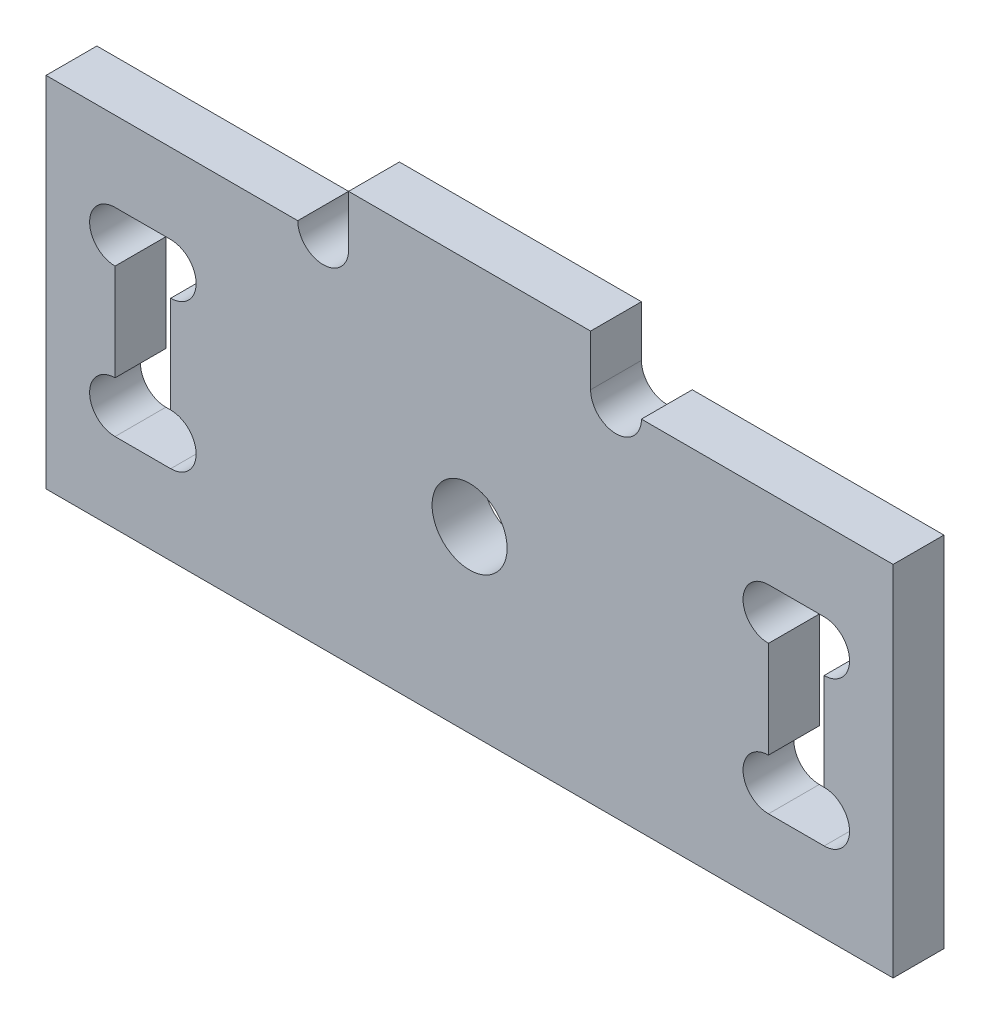
from build123d import *

# Parameters (mm, degrees)
SKETCH_1_R      = 1.55
EXTRUDE_1_DEPTH = 2.1


with BuildPart() as part:
    # 草图1 → 凸台-拉伸1 (new body)
    with BuildSketch(Plane.XY):
        with BuildLine():
            Line((-17.5, -7.4), (17.5, -7.4))
            Line((17.5, -7.4), (17.5, 7.4))
            Line((17.5, 7.4), (7.1, 7.4))
            ThreePointArc((7.1, 7.4), (6.05, 6.35), (5, 7.4))
            Line((5, 7.4), (5, 9.5))
            Line((5, 9.5), (-5, 9.5))
            Line((-5, 9.5), (-5, 7.4))
            ThreePointArc((-5, 7.4), (-6.05, 6.35), (-7.1, 7.4))
            Line((-7.1, 7.4), (-17.5, 7.4))
            Line((-17.5, 7.4), (-17.5, -7.4))
        make_face()
        with BuildLine():
            Line((-12.35, -4.1), (-14.65, -4.1))
            ThreePointArc((-14.65, -4.1), (-15.7, -3.05), (-14.65, -2))
            Line((-14.65, -2), (-14.65, 2))
            ThreePointArc((-14.65, 2), (-15.7, 3.05), (-14.65, 4.1))
            Line((-14.65, 4.1), (-12.35, 4.1))
            ThreePointArc((-12.35, 4.1), (-11.3, 3.05), (-12.35, 2))
            Line((-12.35, 2), (-12.35, -2))
            ThreePointArc((-12.35, -2), (-11.3, -3.05), (-12.35, -4.1))
        make_face(mode=Mode.SUBTRACT)
        Circle(SKETCH_1_R, mode=Mode.SUBTRACT)
        with BuildLine():
            ThreePointArc((12.35, 2), (11.3, 3.05), (12.35, 4.1))
            Line((12.35, 4.1), (14.65, 4.1))
            ThreePointArc((14.65, 4.1), (15.7, 3.05), (14.65, 2))
            Line((14.65, 2), (14.65, -2))
            ThreePointArc((14.65, -2), (15.7, -3.05), (14.65, -4.1))
            Line((14.65, -4.1), (12.35, -4.1))
            ThreePointArc((12.35, -4.1), (11.3, -3.05), (12.35, -2))
            Line((12.35, -2), (12.35, 2))
        make_face(mode=Mode.SUBTRACT)
    extrude(amount=EXTRUDE_1_DEPTH)


solid = part.part
